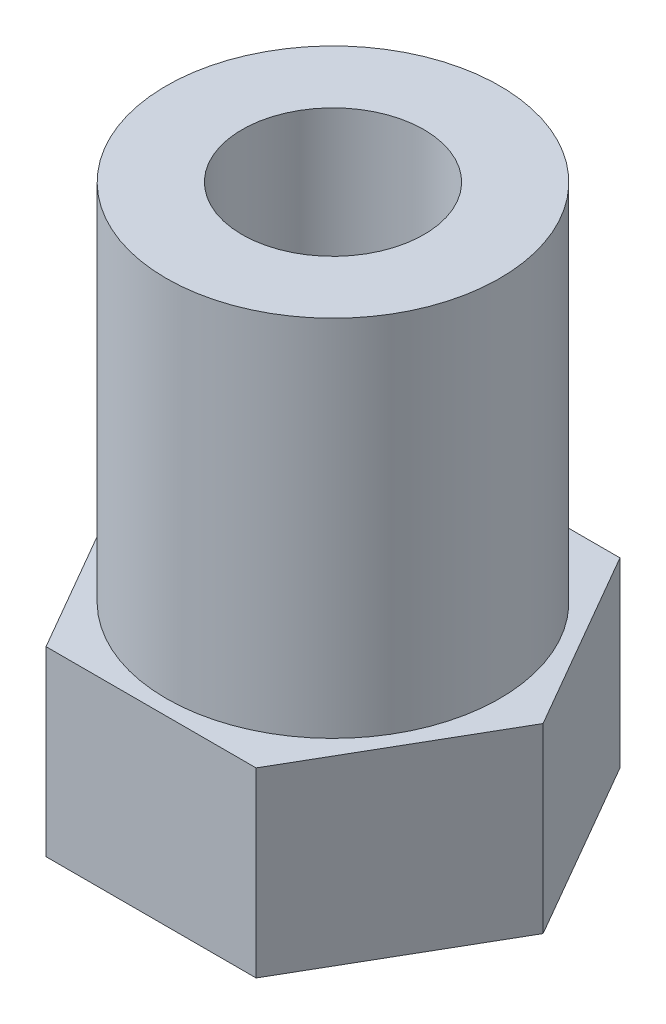
from build123d import *

# Parameters (mm, degrees)
SKETCH_1_R      = 3
EXTRUDE_1_DEPTH = 6
SKETCH_2_R      = 5.5
SKETCH_2_R_2    = 3
EXTRUDE_2_DEPTH = 12


with BuildPart() as part:
    # 草图1 → 凸台-拉伸1 (new body)
    with BuildSketch(Plane(origin=(0, 0, 0), x_dir=(1, 0, 0), z_dir=(0, 1, 0))):
        Polygon((6.92820323, 0), (3.464101615, 6), (-3.464101615, 6), (-6.92820323, 0), (-3.464101615, -6), (3.464101615, -6), align=None)
        with Locations(Location((0, 0, 0), (0, 0, 270))):
            Circle(SKETCH_1_R, mode=Mode.SUBTRACT)
    extrude(amount=EXTRUDE_1_DEPTH)

    # 草图2 → 凸台-拉伸2 (add)
    with BuildSketch(Plane(origin=(0, 6, 0), x_dir=(1, 0, 0), z_dir=(0, 1, 0))):
        with Locations(Location((0, 0, 0), (0, 0, 270))):
            Circle(SKETCH_2_R)
        with Locations(Location((0, 0, 0), (0, 0, 270))):
            Circle(SKETCH_2_R_2, mode=Mode.SUBTRACT)
    extrude(amount=EXTRUDE_2_DEPTH)


solid = part.part
